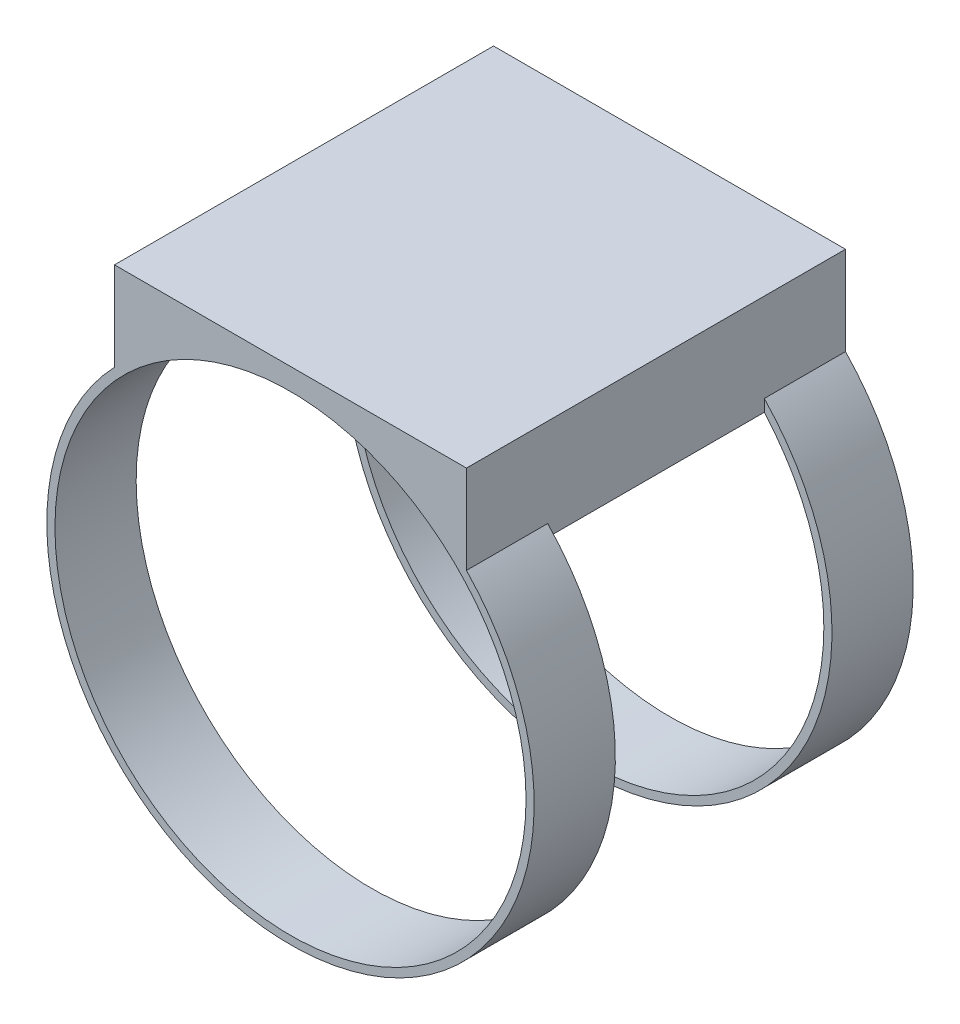
from build123d import *

# Parameters (mm, degrees)
SKETCH1_R                       = 90
SKETCH1_R_2                     = 87
BOSS_EXTRUDE1_DEPTH             = 30
BOSS_EXTRUDE2_REACH             = 205.47
SKETCH2_W                       = 130
SKETCH2_H                       = 30
BOSS_EXTRUDE2_DIRECTION_2_DEPTH = 5
BOSS_EXTRUDE3_DEPTH             = 40


with BuildPart() as part:
    # Sketch1 → Boss-Extrude1 (new body)
    with BuildSketch(Plane.XY):
        Circle(SKETCH1_R)
        Circle(SKETCH1_R_2, mode=Mode.SUBTRACT)
    extrude(amount=BOSS_EXTRUDE1_DEPTH)

    # Boss-Extrude2: up to this face of the body
    boss_extrude2_end = part.part.faces().sort_by_distance((-90, 0, 15))[0]
    # Sketch2 → Boss-Extrude2 (add, up to the picked face)
    with BuildSketch(Plane(origin=(0, 90, 0), x_dir=(1, 0, 0), z_dir=(0, 1, 0)), mode=Mode.PRIVATE) as boss_extrude2_sk1:
        with Locations((0, -15)):
            Rectangle(SKETCH2_W, SKETCH2_H)
    boss_extrude2_tool1 = split(extrude(boss_extrude2_sk1.sketch, amount=-BOSS_EXTRUDE2_REACH, mode=Mode.PRIVATE), bisect_by=boss_extrude2_end, keep=Keep.BOTH, mode=Mode.PRIVATE)
    add(boss_extrude2_tool1.solids().sort_by(Axis((0, 90, 15), (0, -1, 0)))[0])
    add(boss_extrude2_tool1.solids().sort_by(Axis((0, 90, 15), (0, -1, 0)))[1])

    # Sketch2 → Boss-Extrude2 direction 2 (add)
    with BuildSketch(Plane(origin=(0, 90, 0), x_dir=(1, 0, 0), z_dir=(0, 1, 0))):
        with Locations((0, -15)):
            Rectangle(SKETCH2_W, SKETCH2_H)
    extrude(amount=BOSS_EXTRUDE2_DIRECTION_2_DEPTH)

    # Sketch3 → Boss-Extrude3 (add)
    with BuildSketch(Plane.XY.offset(30)):
        with BuildLine():
            Line((65, 95), (-65, 95))
            Line((-65, 95), (-65, 62.24949799))
            Line((-65, 62.24949799), (-65, 57.827329179))
            ThreePointArc((-65, 57.827329179), (0, 87), (65, 57.827329179))
            Line((65, 57.827329179), (65, 62.24949799))
            Line((65, 62.24949799), (65, 95))
        make_face()
    extrude(amount=BOSS_EXTRUDE3_DEPTH)

    # Mirror2: part across plane


with BuildPart() as part_1:
    add(part.part)
    add(part.part.mirror(Plane.XY.offset(70)))


solid = part_1.part
